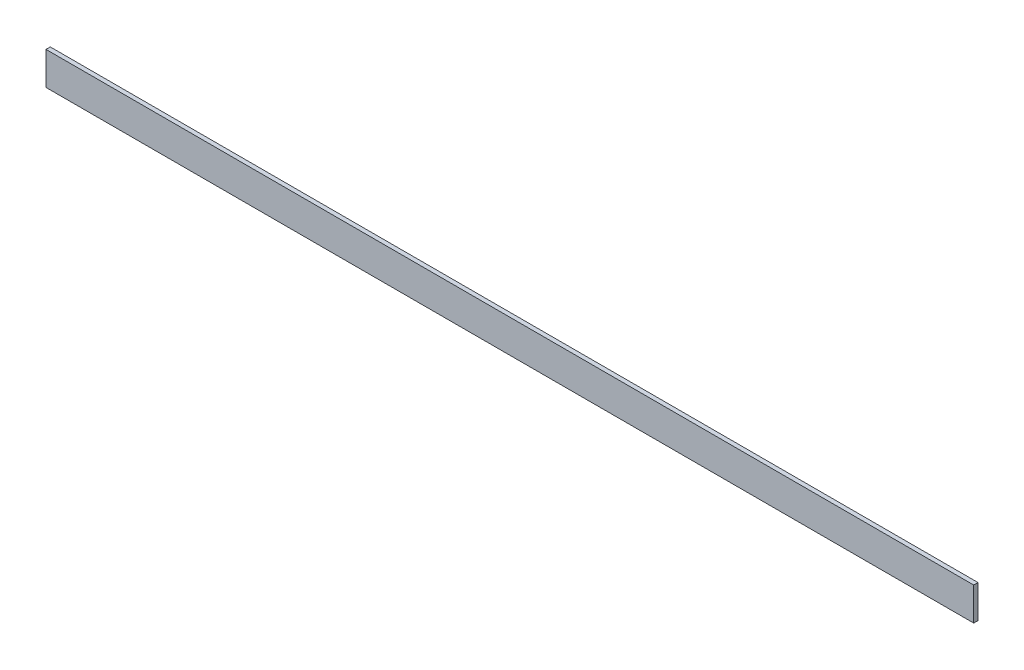
from build123d import *

# Parameters (mm, degrees)
SKETCH1_W           = 714.502
SKETCH1_H           = 25.4
BOSS_EXTRUDE1_DEPTH = 3.302


with BuildPart() as part:
    # Sketch1 → Boss-Extrude1 (new body)
    with BuildSketch(Plane.XY):
        with Locations((357.251, 12.7)):
            Rectangle(SKETCH1_W, SKETCH1_H)
    extrude(amount=BOSS_EXTRUDE1_DEPTH)


solid = part.part
